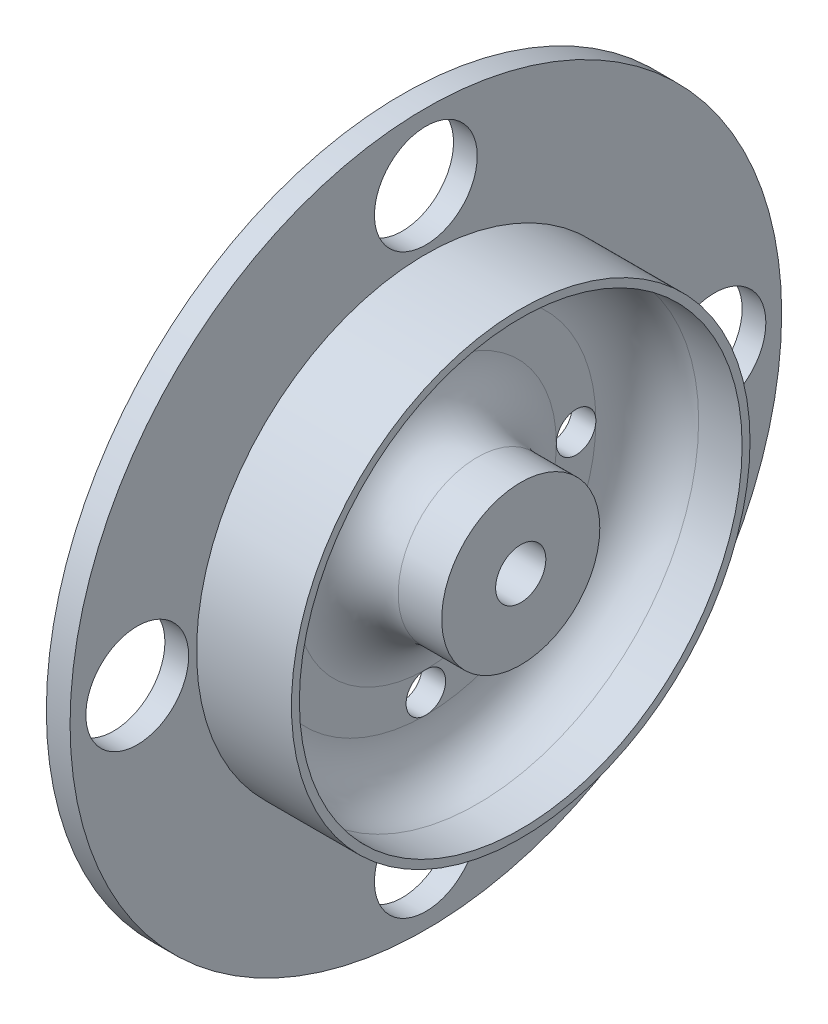
from build123d import *

# Parameters (mm, degrees)
SPROCKET_R                   = 45
ESTRUSIONE_ESTRUSIONE2_DEPTH = 3
SCHIZZO4_R                   = 10
ESTRUSIONE_ESTRUSIONE4_DEPTH = 12
SCHIZZO5_R                   = 29
SCHIZZO5_R_2                 = 28
ESTRUSIONE_ESTRUSIONE5_DEPTH = 12
SCHIZZO6_R                   = 3.175
TAGLIO_ESTRUSIONE1_DEPTH     = 15
RACCORDO1_R                  = 6.5
SCHIZZO7_R                   = 6.5
SCHIZZO7_R_2                 = 2.5
TAGLIO_ESTRUSIONE2_DEPTH     = 65.761099435
SCALE1_SCALE                 = 0.888888889


with BuildPart() as part:
    # Sprocket → Estrusione-Estrusione2 (new body)
    with BuildSketch(Plane(origin=(0, 0, 0), x_dir=(0, 0, -1), z_dir=(1, 0, 0))):
        Circle(SPROCKET_R)
    extrude(amount=ESTRUSIONE_ESTRUSIONE2_DEPTH)

    # Schizzo4 → Estrusione-Estrusione4 (add)
    with BuildSketch(Plane(origin=(3, 0, 0), x_dir=(0, 0, -1), z_dir=(1, 0, 0))):
        Circle(SCHIZZO4_R)
    extrude(amount=ESTRUSIONE_ESTRUSIONE4_DEPTH)

    # Schizzo5 → Estrusione-Estrusione5 (add)
    with BuildSketch(Plane(origin=(3, 0, 0), x_dir=(0, 0, -1), z_dir=(1, 0, 0))):
        Circle(SCHIZZO5_R)
        Circle(SCHIZZO5_R_2, mode=Mode.SUBTRACT)
    extrude(amount=ESTRUSIONE_ESTRUSIONE5_DEPTH)

    # Schizzo6 → Taglio-Estrusione1 (cut)
    with BuildSketch(Plane(origin=(15, 0, 0), x_dir=(0, 0, -1), z_dir=(1, 0, 0))):
        Circle(SCHIZZO6_R)
    extrude(amount=-TAGLIO_ESTRUSIONE1_DEPTH, mode=Mode.SUBTRACT)

    # Raccordo1
    raccordo1_edges = [part.edges().sort_by_distance(p)[0] for p in [
        (3, 0, 10),
        (3, 0, 28),
    ]]
    fillet(raccordo1_edges, radius=RACCORDO1_R)

    # Schizzo7 → Taglio-Estrusione2 (cut, through all)
    with BuildSketch(Plane(origin=(3, 0, 0), x_dir=(0, 0, -1), z_dir=(1, 0, 0))):
        with Locations((0, 36.5)):
            Circle(SCHIZZO7_R)
        with Locations((36.5, 0)):
            Circle(SCHIZZO7_R)
        with Locations((0, -36.5)):
            Circle(SCHIZZO7_R)
        with Locations((-36.5, 0)):
            Circle(SCHIZZO7_R)
        with Locations((0, 19)):
            Circle(SCHIZZO7_R_2)
        with Locations((19, 0)):
            Circle(SCHIZZO7_R_2)
        with Locations((0, -19)):
            Circle(SCHIZZO7_R_2)
        with Locations((-19, 0)):
            Circle(SCHIZZO7_R_2)
    extrude(amount=-TAGLIO_ESTRUSIONE2_DEPTH, mode=Mode.SUBTRACT)


with BuildPart() as part_1:
    # Scale1: scaled about (3.427617089, 0, 0)
    add(part.part.scale(SCALE1_SCALE).moved(Location((0.380846343, 0, 0))))


solid = part_1.part
